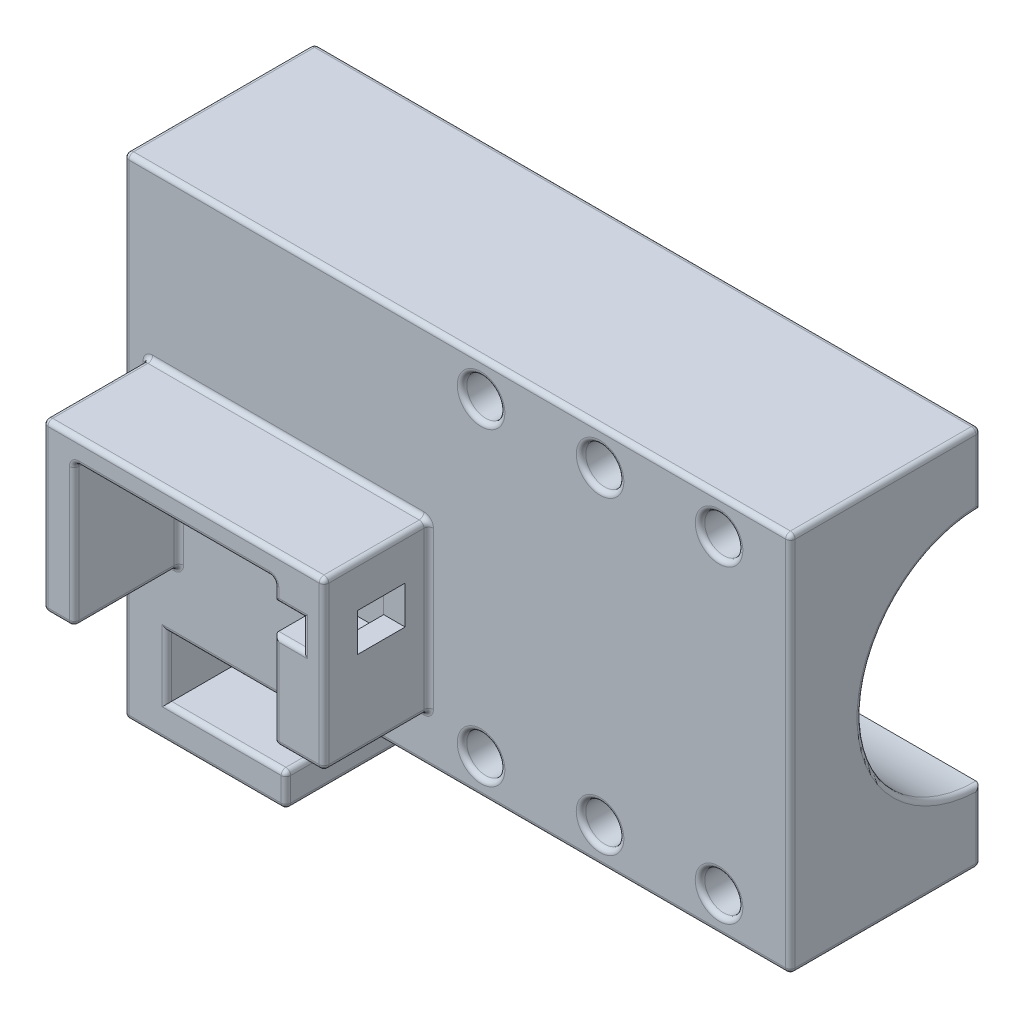
from build123d import *

# Parameters (mm, degrees)
SKETCH5_W            = 80
SKETCH5_H            = 40
BOSS_EXTRUDE2_DEPTH  = 80
SKETCH16_W           = 40
SKETCH16_H           = 80
BOSS_EXTRUDE3_DEPTH  = 60
SKETCH9_R            = 25
CUT_EXTRUDE5_DEPTH   = 167.132477258
BOSS_EXTRUDE5_DEPTH  = 22
SKETCH19_W           = 6
SKETCH19_H           = 10
CUT_EXTRUDE12_DEPTH  = 40
SKETCH21_W           = 4
SKETCH21_H           = 35
BOSS_EXTRUDE6_DEPTH  = 22
SKETCH22_W           = 6
SKETCH22_H           = 10
BOSS_EXTRUDE7_DEPTH  = 15
SKETCH23_W           = 10
SKETCH23_H           = 8
CUT_EXTRUDE13_DEPTH  = 4.5
SKETCH24_R           = 0.75
CUT_EXTRUDE14_DEPTH  = 12
SKETCH25_W           = 18
SKETCH25_H           = 40
BOSS_EXTRUDE8_DEPTH  = 3
BOSS_EXTRUDE9_DEPTH  = 40
SKETCH27_W           = 8
SKETCH27_H           = 14
CUT_EXTRUDE15_DEPTH  = 12.5
SKETCH28_W           = 26
SKETCH28_H           = 1
BOSS_EXTRUDE10_DEPTH = 40
SKETCH29_W           = 1
SKETCH29_H           = 13
BOSS_EXTRUDE11_DEPTH = 40
SKETCH30_R           = 2.375
CUT_EXTRUDE16_DEPTH  = 121
SKETCH33_R           = 4
CUT_EXTRUDE17_DEPTH  = 25
SKETCH34_W           = 6
SKETCH34_H           = 6
CUT_EXTRUDE18_DEPTH  = 10
FILLET1_R            = 1


with BuildPart() as part:
    # Sketch5 → Boss-Extrude2 (new body)
    with BuildSketch(Plane(origin=(0, 0, 0), x_dir=(1, 0, 0), z_dir=(0, 1, 0))):
        with Locations((40, 20)):
            Rectangle(SKETCH5_W, SKETCH5_H)
    extrude(amount=BOSS_EXTRUDE2_DEPTH)

    # Sketch16 → Boss-Extrude3 (add)
    with BuildSketch(Plane.ZY):
        with Locations((-20, 40)):
            Rectangle(SKETCH16_W, SKETCH16_H)
    extrude(amount=BOSS_EXTRUDE3_DEPTH)

    # Sketch9 → Cut-Extrude5 (cut, through all)
    with BuildSketch(Plane(origin=(80, 0, 0), x_dir=(0, 0, -1), z_dir=(1, 0, 0))):
        with Locations((40, 40)):
            Circle(SKETCH9_R)
    extrude(amount=-CUT_EXTRUDE5_DEPTH, mode=Mode.SUBTRACT)

    # Sketch18 → Boss-Extrude5 (add)
    with BuildSketch(Plane.XY):
        Polygon((-55, 45), (-55, 10), (-48.5, 10), (-48.5, 40), (-6.5, 40), (-6.5, 10), (0, 10), (0, 45), align=None)
    extrude(amount=BOSS_EXTRUDE5_DEPTH)

    # Sketch19 → Cut-Extrude12 (cut)
    with BuildSketch(Plane.XZ):
        with Locations((-3.5, 10)):
            Rectangle(SKETCH19_W, SKETCH19_H)
    extrude(amount=-CUT_EXTRUDE12_DEPTH, mode=Mode.SUBTRACT)

    # Sketch21 → Boss-Extrude6 (add)
    with BuildSketch(Plane.XY):
        with Locations((2, 27.5)):
            Rectangle(SKETCH21_W, SKETCH21_H)
    extrude(amount=BOSS_EXTRUDE6_DEPTH)

    # Sketch22 → Boss-Extrude7 (add)
    with BuildSketch(Plane(origin=(0, 10, 0), x_dir=(-1, 0, 0), z_dir=(0, -1, 0))):
        with Locations((3.5, -10)):
            Rectangle(SKETCH22_W, SKETCH22_H)
    extrude(amount=-BOSS_EXTRUDE7_DEPTH)

    # Sketch23 → Cut-Extrude13 (cut)
    with BuildSketch(Plane.ZY.offset(0.5)):
        with Locations((9.951194317, 32)):
            Rectangle(SKETCH23_W, SKETCH23_H)
    extrude(amount=-CUT_EXTRUDE13_DEPTH, mode=Mode.SUBTRACT)

    # Sketch24 → Cut-Extrude14 (cut)
    with BuildSketch(Plane(origin=(0, 10, 0), x_dir=(-1, 0, 0), z_dir=(0, -1, 0))):
        with Locations(Location((51.5, -5, 0), (0, 0, 90))):
            Circle(SKETCH24_R)
        with Locations(Location((51.5, -15, 0), (0, 0, 90))):
            Circle(SKETCH24_R)
        with Locations(Location((3.5, -15, 0), (0, 0, 90))):
            Circle(SKETCH24_R)
        with Locations(Location((3.5, -5, 0), (0, 0, 90))):
            Circle(SKETCH24_R)
    extrude(amount=-CUT_EXTRUDE14_DEPTH, mode=Mode.SUBTRACT)

    # Sketch25 → Boss-Extrude8 (add)
    with BuildSketch(Plane.XZ):
        with Locations((-43, -20)):
            Rectangle(SKETCH25_W, SKETCH25_H)
    extrude(amount=BOSS_EXTRUDE8_DEPTH)

    # Sketch26 → Boss-Extrude9 (add, through all)
    with BuildSketch(Plane.XY):
        Polygon((-52, 0), (-60, 0), (-60, -23), (-26, -23), (-26, 0), (-34, 0), (-34, -3), (-34, -17), (-52, -17), (-52, -3), align=None)
    extrude(amount=-BOSS_EXTRUDE9_DEPTH)

    # Sketch27 → Cut-Extrude15 (cut)
    with BuildSketch(Plane.XY):
        with Locations((-30, -10)):
            Rectangle(SKETCH27_W, SKETCH27_H)
    extrude(amount=-CUT_EXTRUDE15_DEPTH, mode=Mode.SUBTRACT)

    # Sketch28 → Boss-Extrude10 (add, through all)
    with BuildSketch(Plane.XY):
        with Locations((-39, -16.5)):
            Rectangle(SKETCH28_W, SKETCH28_H)
    extrude(amount=-BOSS_EXTRUDE10_DEPTH)

    # Sketch29 → Boss-Extrude11 (add, through all)
    with BuildSketch(Plane.XY):
        with Locations((-51.5, -9.5)):
            Rectangle(SKETCH29_W, SKETCH29_H)
    extrude(amount=-BOSS_EXTRUDE11_DEPTH)

    # Sketch30 → Cut-Extrude16 (cut, through all)
    with BuildSketch(Plane.XY):
        with Locations((15, 72.5)):
            Circle(SKETCH30_R)
        with Locations((40, 72.5)):
            Circle(SKETCH30_R)
        with Locations((65, 72.5)):
            Circle(SKETCH30_R)
        with Locations((15, 7.5)):
            Circle(SKETCH30_R)
        with Locations((40, 7.5)):
            Circle(SKETCH30_R)
        with Locations((65, 7.5)):
            Circle(SKETCH30_R)
    extrude(amount=-CUT_EXTRUDE16_DEPTH, mode=Mode.SUBTRACT)

    # Sketch33 → Cut-Extrude17 (cut)
    with BuildSketch(Plane.XY):
        with Locations((15, 7.5)):
            Circle(SKETCH33_R)
        with Locations((40, 7.5)):
            Circle(SKETCH33_R)
        with Locations((65, 7.5)):
            Circle(SKETCH33_R)
        with Locations((65, 72.5)):
            Circle(SKETCH33_R)
        with Locations((40, 72.5)):
            Circle(SKETCH33_R)
        with Locations((15, 72.5)):
            Circle(SKETCH33_R)
    extrude(amount=-CUT_EXTRUDE17_DEPTH, mode=Mode.SUBTRACT)

    # Sketch34 → Cut-Extrude18 (cut)
    with BuildSketch(Plane.XY.offset(22)):
        with Locations((-3.5, 33)):
            Rectangle(SKETCH34_W, SKETCH34_H)
    extrude(amount=-CUT_EXTRUDE18_DEPTH, mode=Mode.SUBTRACT)

    # Fillet1
    fillet1_edges = [part.edges().sort_by_distance(p)[0] for p in [
        (80, 40, 0),
        (27, 0, 0),
        (10, 80, 0),
        (-26, -1.5, 0),
        (-60, 28.5, 0),
        (-38.5, -3, 0),
        (-43, -23, 0),
        (-51, -9.5, 0),
        (-26, -19.5, 0),
        (-38.5, -16, 0),
        (11, 72.5, 0),
        (36, 72.5, 0),
        (61, 72.5, 0),
        (4, 27.5, 0),
        (-25.5, 45, 0),
        (-1.25, 10, 0),
        (-55, 27.5, 0),
        (-6.5, 25, 0),
        (-51.75, 10, 0),
        (-27.5, 40, 0),
        (-48.5, 25, 0),
        (11, 7.5, 0),
        (36, 7.5, 0),
        (61, 7.5, 0),
        (-26, -11.5, -40),
        (-43, -23, -40),
        (27, 0, -40),
        (-60, -4, -40),
        (80, 7.5, -40),
        (-34, -3, -26.25),
        (-26, -9.5, -12.5),
        (80, 40, -15),
        (-60, 40, -15),
        (-60, 72.5, -40),
        (80, 72.5, -40),
        (10, 80, -40),
        (-48.5, 10, 11),
        (-48.5, 40, 11),
        (-48.5, 25, 22),
        (-25.5, 45, 22),
        (-55, 27.5, 22),
        (-51.75, 10, 22),
        (-27.5, 40, 22),
        (-6.5, 38, 22),
        (-3.5, 36, 22),
        (-0.5, 33, 22),
        (-3.5, 30, 22),
        (-6.5, 20, 22),
        (-1.25, 10, 22),
        (4, 27.5, 22),
        (-0.5, 25, 10),
        (-3.5, 40, 5),
        (-0.5, 36, 9.975597159),
        (-0.5, 40, 10),
        (-3.5, 40, 15),
        (-6.5, 40, 18.5),
        (-6.5, 40, 2.5),
        (-55, 10, 11),
        (-51.5, 10, 15.75),
        (-51.5, 10, 5.75),
        (-6.5, 10, 11),
        (-55, 45, 11),
        (4, 10, 11),
        (-3.5, 10, 15.75),
        (-3.5, 10, 5.75),
        (4, 45, 11),
        (-26, -16, -6.25),
        (-60, -23, -20),
        (-26, -23, -20),
        (-26, -3, -6.25),
        (-60, 80, -20),
        (-26, 0, -20),
        (80, 80, -20),
        (80, 0, -20),
    ]]
    fillet(fillet1_edges, radius=FILLET1_R)


solid = part.part
